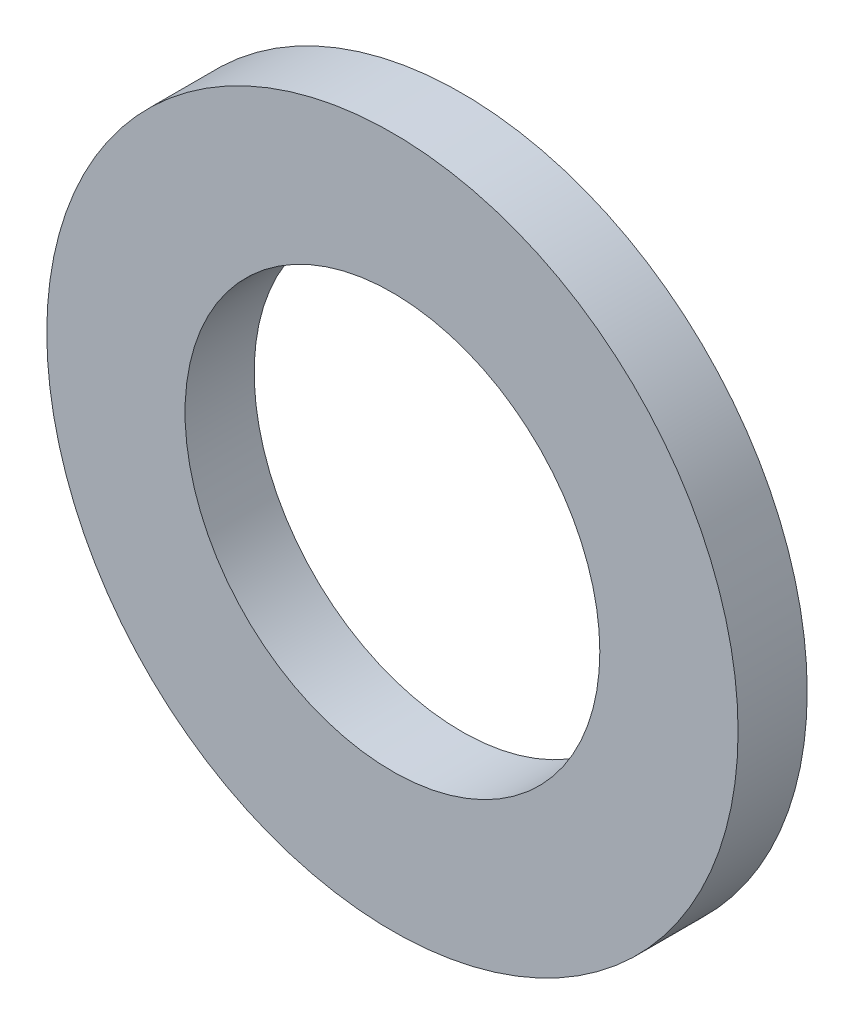
from build123d import *

# Parameters (mm, degrees)
SKETCH1_R      = 10
SKETCH1_R_2    = 6
EXTRUDE1_DEPTH = 1


with BuildPart() as part:
    # Sketch1 → Extrude1 (new, symmetric)
    with BuildSketch(Plane.XY):
        Circle(SKETCH1_R)
        Circle(SKETCH1_R_2, mode=Mode.SUBTRACT)
    extrude(amount=EXTRUDE1_DEPTH, both=True)


solid = part.part
